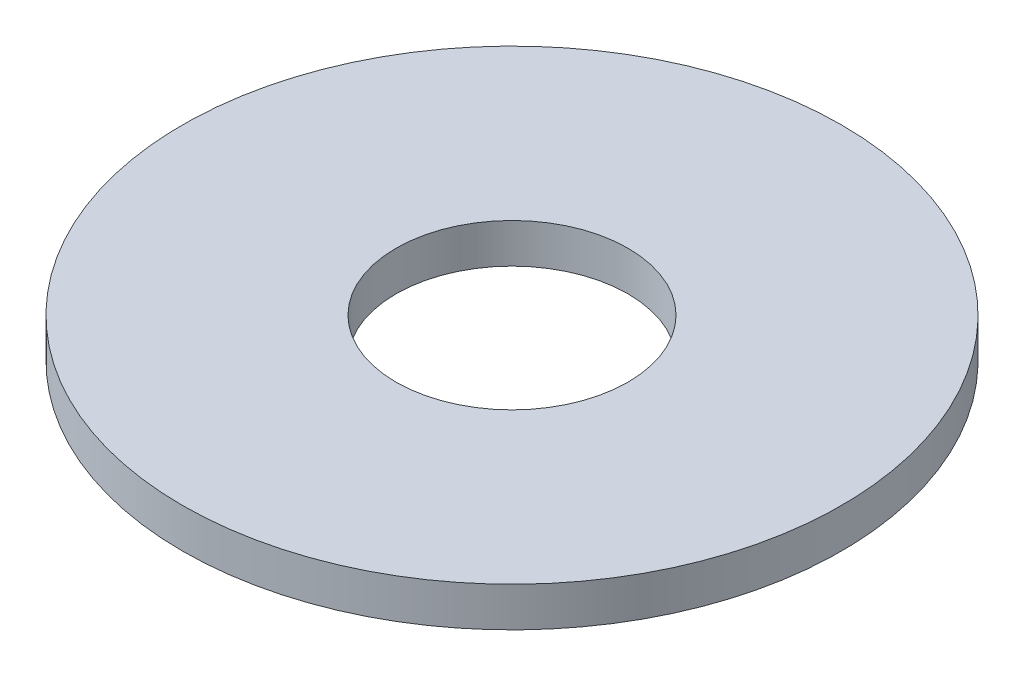
from build123d import *

# Parameters (mm, degrees)
SKETCH1_R           = 12.5
SKETCH1_R_2         = 4.4
BOSS_EXTRUDE1_DEPTH = 1.5


with BuildPart() as part:
    # Sketch1 → Boss-Extrude1 (new body)
    with BuildSketch(Plane(origin=(0, 0, 0), x_dir=(1, 0, 0), z_dir=(0, 1, 0))):
        with Locations(Location((0, 0, 0), (0, 0, 270))):
            Circle(SKETCH1_R)
        with Locations(Location((0, 0, 0), (0, 0, 270))):
            Circle(SKETCH1_R_2, mode=Mode.SUBTRACT)
    extrude(amount=BOSS_EXTRUDE1_DEPTH)


solid = part.part
